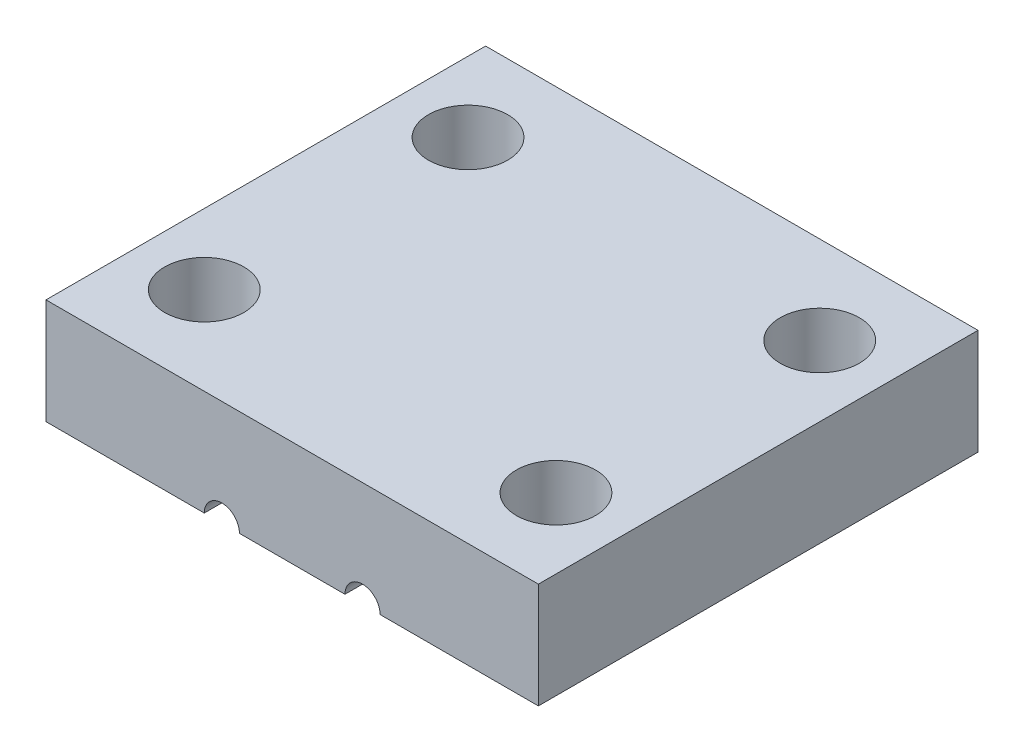
from build123d import *

# Parameters (mm, degrees)
SKETCH1_W           = 28
SKETCH1_H           = 6
BOSS_EXTRUDE1_DEPTH = 12.5
SKETCH2_R           = 1
CUT_EXTRUDE1_DEPTH  = 435
SKETCH3_R           = 2.25
CUT_EXTRUDE2_DEPTH  = 20.704060495


with BuildPart() as part:
    # Sketch1 → Boss-Extrude1 (new, symmetric)
    with BuildSketch(Plane.XY):
        with Locations((0, 3)):
            Rectangle(SKETCH1_W, SKETCH1_H)
    extrude(amount=BOSS_EXTRUDE1_DEPTH, both=True)

    # Sketch2 → Cut-Extrude1 (cut)
    with BuildSketch(Plane.XY.offset(12.5)):
        with Locations((-4, 0)):
            Circle(SKETCH2_R)
        with Locations((4, 0)):
            Circle(SKETCH2_R)
    extrude(amount=-CUT_EXTRUDE1_DEPTH, mode=Mode.SUBTRACT)

    # Sketch3 → Cut-Extrude2 (cut, through all)
    with BuildSketch(Plane(origin=(0, 6, 0), x_dir=(1, 0, 0), z_dir=(0, 1, 0))):
        with Locations(Location((-10, 7.5, 0), (0, 0, 270))):
            Circle(SKETCH3_R)
        with Locations(Location((-10, -7.5, 0), (0, 0, 270))):
            Circle(SKETCH3_R)
        with Locations(Location((10, -7.5, 0), (0, 0, 270))):
            Circle(SKETCH3_R)
        with Locations(Location((10, 7.5, 0), (0, 0, 270))):
            Circle(SKETCH3_R)
    extrude(amount=-CUT_EXTRUDE2_DEPTH, mode=Mode.SUBTRACT)


solid = part.part
